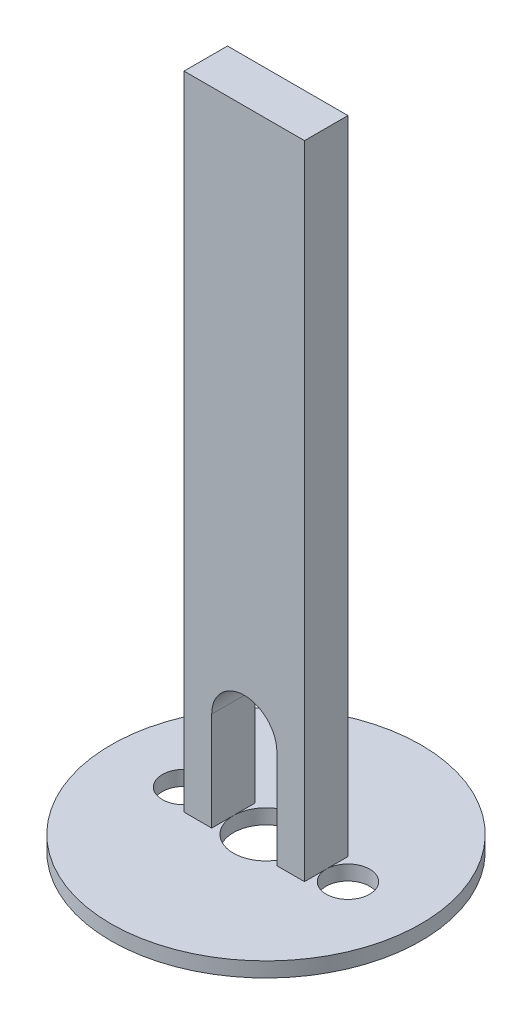
from build123d import *

# Parameters (mm, degrees)
SKETCH1_R               = 15.7
SKETCH1_R_2             = 3.3
SKETCH1_R_3             = 2.2
BOSS_EXTRUDE1_DEPTH     = 1.5
SKETCH2_W               = 12.2
SKETCH2_H               = 4.4
BOSS_EXTRUDE2_DEPTH     = 65
CUT_EXTRUDE1_DEPTH      = 71.633915366
CUT_EXTRUDE1_DEPTH_BACK = 90


with BuildPart() as part:
    # Sketch1 → Boss-Extrude1 (new body)
    with BuildSketch(Plane(origin=(0, 0, 0), x_dir=(1, 0, 0), z_dir=(0, 1, 0))):
        with Locations(Location((0, 0, 0), (0, 0, 270))):
            Circle(SKETCH1_R)
        with Locations(Location((0, 0, 0), (0, 0, 270))):
            Circle(SKETCH1_R_2, mode=Mode.SUBTRACT)
        with Locations(Location((-8.3, 0, 0), (0, 0, 270))):
            Circle(SKETCH1_R_3, mode=Mode.SUBTRACT)
        with Locations(Location((8.3, 0, 0), (0, 0, 270))):
            Circle(SKETCH1_R_3, mode=Mode.SUBTRACT)
    extrude(amount=BOSS_EXTRUDE1_DEPTH)

    # Sketch2 → Boss-Extrude2 (add)
    with BuildSketch(Plane(origin=(0, 1.5, 0), x_dir=(1, 0, 0), z_dir=(0, 1, 0))):
        Rectangle(SKETCH2_W, SKETCH2_H)
    extrude(amount=BOSS_EXTRUDE2_DEPTH)

    # Sketch4 → Cut-Extrude1 (cut, two sides: drawn at the far end of the back side and taken through both)
    with BuildSketch(Plane.XY.offset(2.2).offset(-CUT_EXTRUDE1_DEPTH_BACK)):
        with BuildLine():
            ThreePointArc((3.3, 11.5), (2.333452378, 13.833452378), (0, 14.8))
            Line((0, 14.8), (0, 1.5))
            Line((0, 1.5), (2.459674775, 1.5))
            Line((2.459674775, 1.5), (3.3, 1.5))
            Line((3.3, 1.5), (3.3, 11.5))
        make_face()
        with BuildLine():
            Line((-3.3, 11.5), (-3.3, 1.5))
            Line((-3.3, 1.5), (-2.459674775, 1.5))
            Line((-2.459674775, 1.5), (0, 1.5))
            Line((0, 1.5), (0, 14.8))
            ThreePointArc((0, 14.8), (-2.333452378, 13.833452378), (-3.3, 11.5))
        make_face()
    extrude(amount=CUT_EXTRUDE1_DEPTH + CUT_EXTRUDE1_DEPTH_BACK, mode=Mode.SUBTRACT)


solid = part.part
